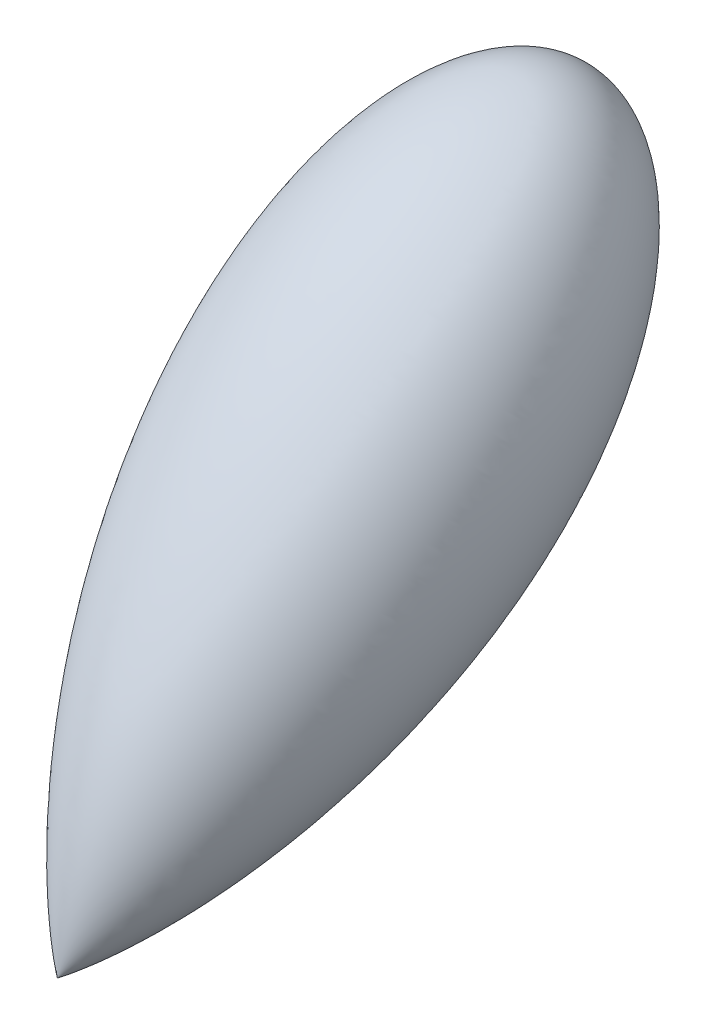
from build123d import *


with BuildPart() as part:
    # Sketch1 → Revolve1 (revolve)
    with BuildSketch(Plane(origin=(0, 0, 0), x_dir=(0, 0, -1), z_dir=(1, 0, 0))):
        with BuildLine():
            Line((0, 0), (105.5058183, 105.5058183))
            add(Edge.make_bspline(
                [(0, 0), (0.094354721, 0.001105676), (0.283019153, 0.005045213), (0.660167994, 0.019989521), (1.225352561, 0.05324866), (1.883945741, 0.103585971), (2.823433762, 0.191428271), (3.948634707, 0.318275665), (5.562098508, 0.533032851), (7.658630822, 0.868008555), (10.719141764, 1.442275351), (14.723211789, 2.347736284), (19.349305834, 3.588553758), (25.877167346, 5.637882883), (33.575688257, 8.497787189), (42.347343945, 12.358125634), (52.054886537, 17.428791548), (61.409119681, 23.124897084), (70.364485783, 29.430333299), (78.862066296, 36.341934764), (86.822966159, 43.86792725), (94.137602482, 52.027587443), (99.810953199, 59.719628075), (103.655436537, 66.140500525), (106.043957237, 70.989075764), (107.366640379, 74.067550549), (108.326529399, 76.593141596), (109.171717735, 79.178044621), (109.884563346, 81.821055201), (110.436792587, 84.48009431), (110.811413655, 87.14811146), (110.974941599, 89.609166927), (110.958203646, 91.847246814), (110.794285365, 93.872190111), (110.520111372, 95.677107616), (110.129953801, 97.360955148), (109.693048876, 98.744766886), (109.266506435, 99.838334959), (108.833271518, 100.804591726), (108.358875962, 101.734315491), (107.831508865, 102.623692821), (107.249165923, 103.471642245), (106.730261812, 104.147555747), (106.342142153, 104.611268887), (106.007845417, 104.985577069), (105.741228976, 105.266740098), (105.600974545, 105.410279047), (105.52514365, 105.486492949), (105.5058183, 105.5058183)],
                knots=[0, 0, 0, 0, 0, 0.002080226, 0.004160452, 0.008320905, 0.012481357, 0.016641809, 0.024962714, 0.033283619, 0.048364, 0.06344438, 0.093605141, 0.123765762, 0.153926382, 0.214247832, 0.274569249, 0.334890549, 0.395211974, 0.455533332, 0.515854718, 0.576176117, 0.63649751, 0.696818879, 0.726204736, 0.740897665, 0.755590594, 0.77067099, 0.785751387, 0.800831654, 0.815911922, 0.830507415, 0.845102909, 0.85515641, 0.865209912, 0.87526354, 0.885317169, 0.893220907, 0.897172776, 0.901124645, 0.908664775, 0.916204906, 0.919974979, 0.923745053, 0.927515126, 0.929400163, 0.9312852, 0.931931757, 0.931931757, 0.931931757, 0.931931757, 0.931931757], degree=4))
        make_face()
    revolve(axis=Axis((0, 105.5058183, -105.5058183), (0, -0.7071067811865475, 0.7071067811865477)))


solid = part.part
